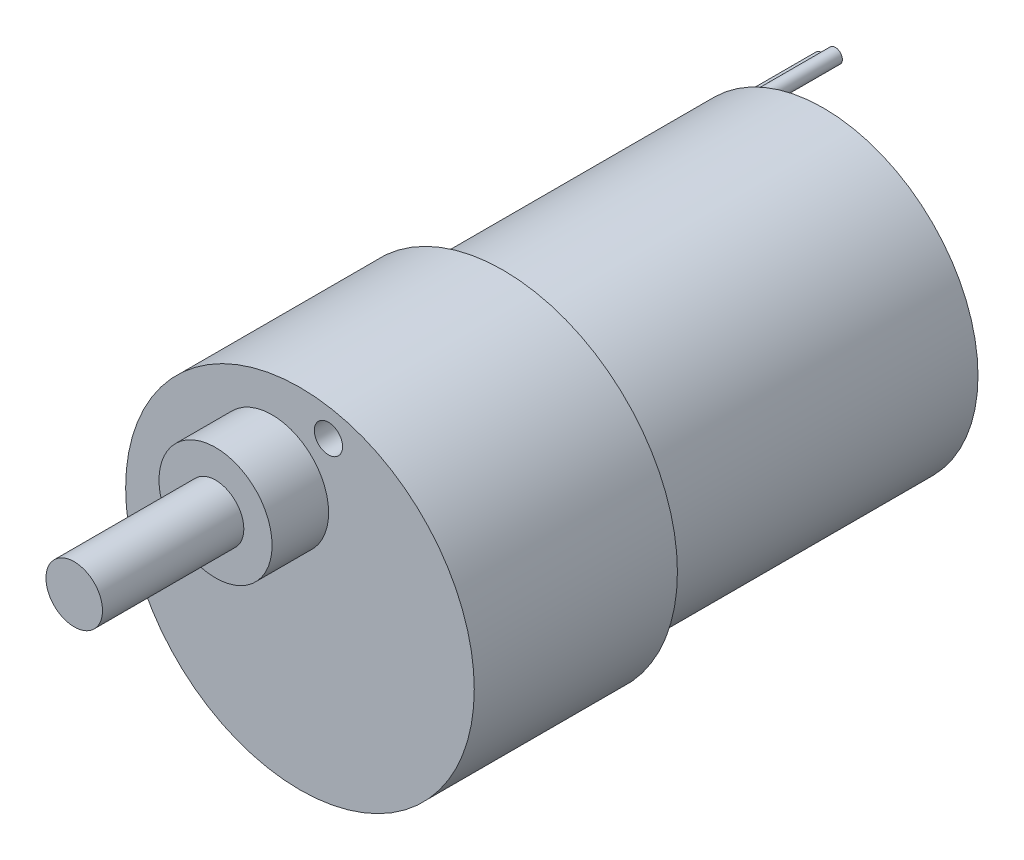
from build123d import *

# Parameters (mm, degrees)
SKETCH1_R           = 18.5
BOSS_EXTRUDE1_DEPTH = 21.56
SKETCH2_R           = 6
BOSS_EXTRUDE2_DEPTH = 6
SKETCH3_R           = 3
BOSS_EXTRUDE3_DEPTH = 15
SKETCH4_R           = 1.5
CUT_EXTRUDE1_DEPTH  = 4
SKETCH5_R           = 16.4
BOSS_EXTRUDE4_DEPTH = 34
SKETCH7_R           = 0.75
BOSS_EXTRUDE5_DEPTH = 10
SKETCH8_R           = 0.75
BOSS_EXTRUDE6_DEPTH = 10


with BuildPart() as part:
    # Sketch1 → Boss-Extrude1 (new body)
    with BuildSketch(Plane.XY):
        with Locations((-38.660623091, 1.939719844)):
            Circle(SKETCH1_R)
    extrude(amount=BOSS_EXTRUDE1_DEPTH)

    # Sketch2 → Boss-Extrude2 (add)
    with BuildSketch(Plane.XY.offset(21.56)):
        with Locations((-41.618854638, 10.439653144)):
            Circle(SKETCH2_R)
    extrude(amount=BOSS_EXTRUDE2_DEPTH)

    # Sketch3 → Boss-Extrude3 (add)
    with BuildSketch(Plane.XY.offset(27.56)):
        with Locations((-41.618854638, 10.439653144)):
            Circle(SKETCH3_R)
    extrude(amount=BOSS_EXTRUDE3_DEPTH)

    # Sketch4 → Cut-Extrude1 (cut)
    with BuildSketch(Plane.XY.offset(21.56)):
        with Locations((-35.638553095, 17.248200675)):
            Circle(SKETCH4_R)
    extrude(amount=-CUT_EXTRUDE1_DEPTH, mode=Mode.SUBTRACT)

    # Sketch5 → Boss-Extrude4 (add)
    with BuildSketch(Plane(origin=(0, 0, 0), x_dir=(-1, 0, 0), z_dir=(0, 0, -1))):
        with Locations((38.660623091, 1.939719844)):
            Circle(SKETCH5_R)
    extrude(amount=BOSS_EXTRUDE4_DEPTH)

    # Sketch7 → Boss-Extrude5 (add)
    with BuildSketch(Plane(origin=(0, 0, -34), x_dir=(-1, 0, 0), z_dir=(0, 0, -1))):
        with Locations((47.406680411, 13.79413532)):
            Circle(SKETCH7_R)
    extrude(amount=BOSS_EXTRUDE5_DEPTH)

    # Sketch8 → Boss-Extrude6 (add)
    with BuildSketch(Plane(origin=(0, 0, -34), x_dir=(-1, 0, 0), z_dir=(0, 0, -1))):
        with Locations((48.902224114, 12.582392087)):
            Circle(SKETCH8_R)
    extrude(amount=BOSS_EXTRUDE6_DEPTH)


solid = part.part
